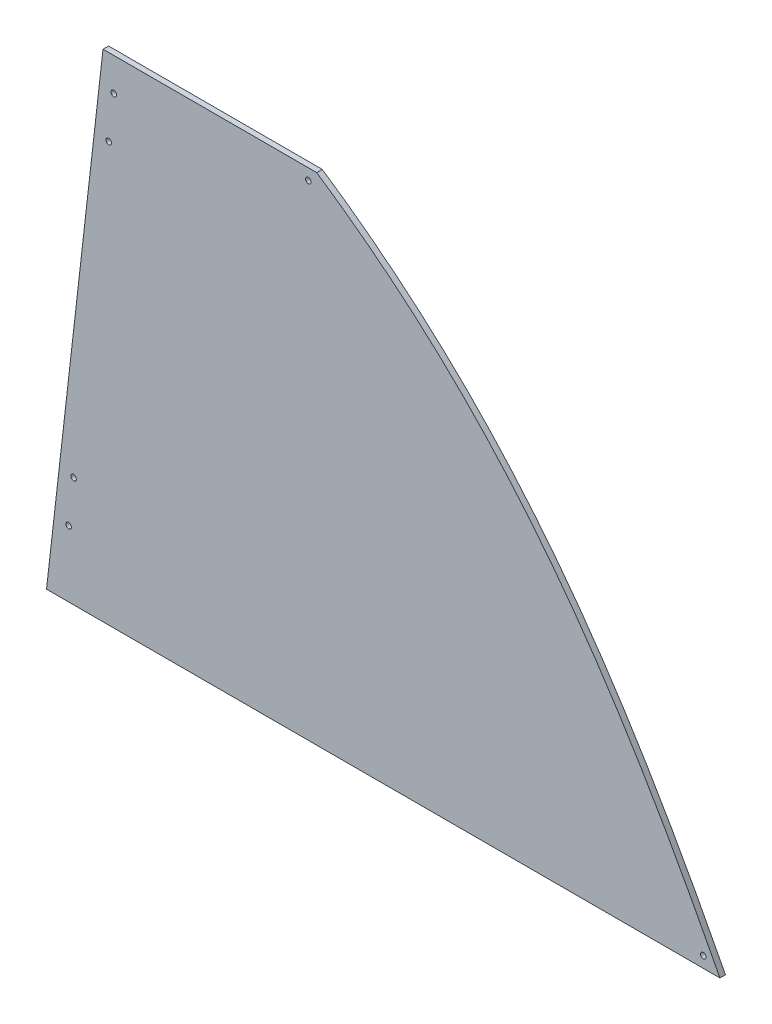
from build123d import *

# Parameters (mm, degrees)
BOSS_EXTRUDE1_DEPTH         = 6.35
BOSS_EXTRUDE2_DEPTH         = 6.35
F_1_4_0_25_DIAMETER_HOLE2_D = 6.35
F_1_4_0_25_DIAMETER_HOLE3_D = 6.35


with BuildPart() as part:
    # Sketch1 → Boss-Extrude1 (new body)
    with BuildSketch(Plane.XY):
        with BuildLine():
            Line((0, 0), (739.14, 0))
            add(Edge.make_bspline(
                [(277.420636668, 567.826315519), (496.859161811, 420.297110317), (620.758181585, 229.590161119), (739.14, 0)],
                knots=[0, 0, 0, 0, 1, 1, 1, 1], degree=3))
            Line((277.420636668, 567.826315519), (64.695636668, 567.826315519))
            Line((64.695636668, 567.826315519), (0, 0))
        make_face()
    extrude(amount=BOSS_EXTRUDE1_DEPTH)

    # Sketch5 → Boss-Extrude2 (add)
    with BuildSketch(Plane(origin=(0, 0, 0), x_dir=(-1, 0, 0), z_dir=(0, 0, -1))):
        Polygon((-64.695636668, 567.826315519), (-32.740222655, 567.826315519), (31.955414013, 0), (0, 0), align=None)
    extrude(amount=-BOSS_EXTRUDE2_DEPTH)

    # 1/4 (0.25) Diameter Hole2 (through all)
    with Locations(Plane.XY.offset(6.35)):
        with Locations((-6.712513837, 75.710175403), (-0.961790578, 126.183625671), (39.293272238, 479.49777755), (45.043995497, 529.971227818)):
            Hole(F_1_4_0_25_DIAMETER_HOLE2_D / 2)

    # 1/4 (0.25) Diameter Hole3 (through all)
    with Locations(Plane.XY.offset(6.35)):
        with Locations((720.09, 12.7), (267.895636668, 555.126315519)):
            Hole(F_1_4_0_25_DIAMETER_HOLE3_D / 2)


solid = part.part
